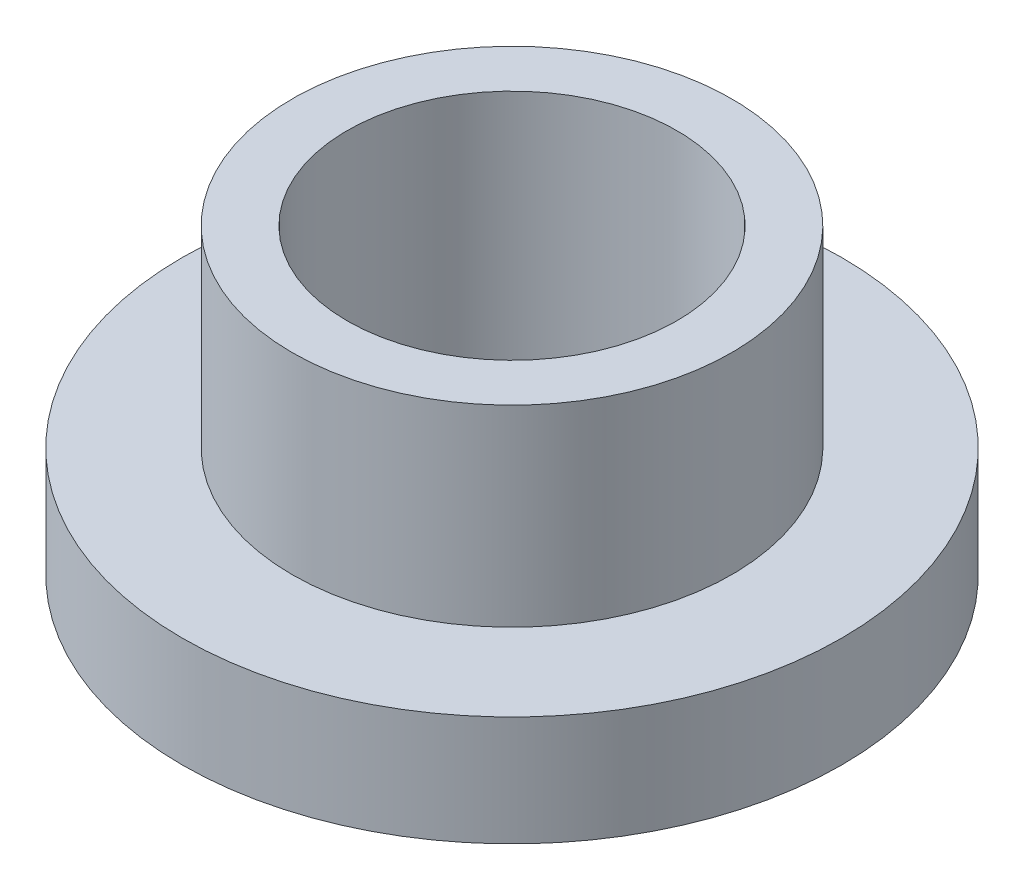
from build123d import *

# Parameters (mm, degrees)
SKETCH1_R           = 6
BOSS_EXTRUDE1_DEPTH = 1
SKETCH2_R           = 4
BOSS_EXTRUDE2_DEPTH = 3.5
SKETCH3_R           = 3
CUT_EXTRUDE1_DEPTH  = 11.111874208


with BuildPart() as part:
    # Sketch1 → Boss-Extrude1 (new, symmetric)
    with BuildSketch(Plane(origin=(0, 0, 0), x_dir=(1, 0, 0), z_dir=(0, 1, 0))):
        with Locations(Location((0, 0, 0), (0, 0, 270))):
            Circle(SKETCH1_R)
    extrude(amount=BOSS_EXTRUDE1_DEPTH, both=True)

    # Sketch2 → Boss-Extrude2 (add)
    with BuildSketch(Plane(origin=(0, 1, 0), x_dir=(1, 0, 0), z_dir=(0, 1, 0))):
        with Locations(Location((0, 0, 0), (0, 0, 270))):
            Circle(SKETCH2_R)
    extrude(amount=BOSS_EXTRUDE2_DEPTH)

    # Sketch3 → Cut-Extrude1 (cut, through all)
    with BuildSketch(Plane(origin=(0, 4.5, 0), x_dir=(1, 0, 0), z_dir=(0, 1, 0))):
        with Locations(Location((0, 0, 0), (0, 0, 270))):
            Circle(SKETCH3_R)
    extrude(amount=-CUT_EXTRUDE1_DEPTH, mode=Mode.SUBTRACT)


solid = part.part
